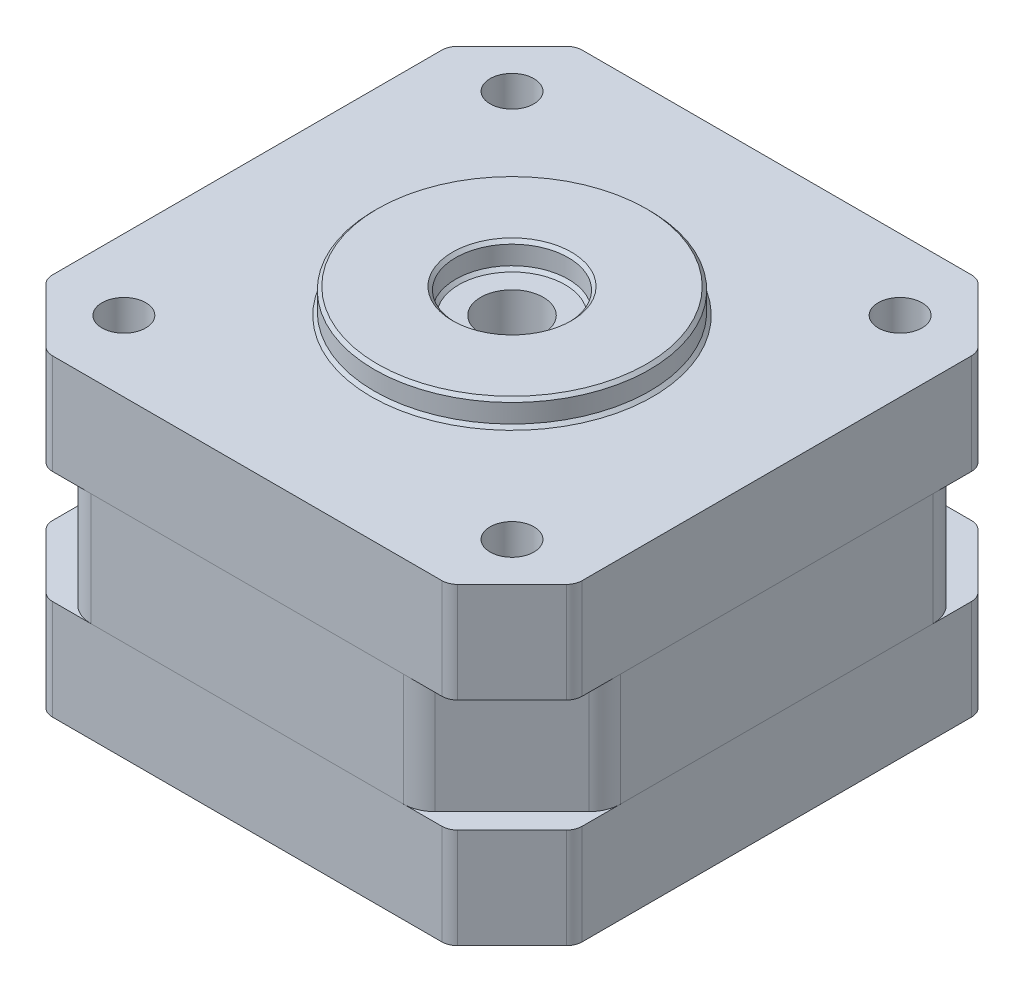
from build123d import *

# Parameters (mm, degrees)
SKETCH1_W           = 42.3
SKETCH1_H           = 42.3
BOSS_EXTRUDE1_DEPTH = 8.001
CHAMFER1_SIZE       = 5.08
SKETCH2_W           = 42.3
SKETCH2_H           = 42.3
BOSS_EXTRUDE2_DEPTH = 8.9916
CHAMFER3_SIZE       = 7.62
FILLET1_R           = 2.54
FILLET2_R           = 1.27
SKETCH3_W           = 42.3
SKETCH3_H           = 42.3
BOSS_EXTRUDE3_DEPTH = 8.001
CHAMFER4_SIZE       = 5.08
FILLET3_R           = 1.27
SKETCH4_R           = 10.9982
SKETCH4_R_2         = 4.4958
BOSS_EXTRUDE4_DEPTH = 2
CHAMFER5_SIZE       = 0.254
SKETCH5_R           = 2.5019
CUT_EXTRUDE1_DEPTH  = 12.7
SKETCH6_R           = 1.75
CUT_EXTRUDE2_DEPTH  = 39.978520251


with BuildPart() as part:
    # Sketch1 → Boss-Extrude1 (new body)
    with BuildSketch(Plane(origin=(0, 0, 0), x_dir=(1, 0, 0), z_dir=(0, 1, 0))):
        Rectangle(SKETCH1_W, SKETCH1_H)
    extrude(amount=BOSS_EXTRUDE1_DEPTH)

    # Chamfer1
    chamfer1_edges = [part.edges().sort_by_distance(p)[0] for p in [
        (21.15, 4.0005, 21.15),
        (-21.15, 4.0005, 21.15),
        (-21.15, 4.0005, -21.15),
        (21.15, 4.0005, -21.15),
    ]]
    chamfer(chamfer1_edges, length=CHAMFER1_SIZE)

    # Fillet2
    fillet2_edges = [part.edges().sort_by_distance(p)[0] for p in [
        (16.07, 4.0005, 21.15),
        (-16.07, 4.0005, 21.15),
        (-21.15, 4.0005, -16.07),
        (-21.15, 4.0005, 16.07),
        (16.07, 4.0005, -21.15),
        (-16.07, 4.0005, -21.15),
        (21.15, 4.0005, 16.07),
        (21.15, 4.0005, -16.07),
    ]]
    fillet(fillet2_edges, radius=FILLET2_R)


with BuildPart() as body_2:
    # Sketch2 → Boss-Extrude2 (new body)
    with BuildSketch(Plane(origin=(0, 8.001, 0), x_dir=(1, 0, 0), z_dir=(0, 1, 0))):
        Rectangle(SKETCH2_W, SKETCH2_H)
    extrude(amount=BOSS_EXTRUDE2_DEPTH)

    # Chamfer3
    chamfer3_edges = [body_2.edges().sort_by_distance(p)[0] for p in [
        (21.15, 12.4968, 21.15),
        (-21.15, 12.4968, 21.15),
        (-21.15, 12.4968, -21.15),
        (21.15, 12.4968, -21.15),
    ]]
    chamfer(chamfer3_edges, length=CHAMFER3_SIZE)

    # Fillet1
    fillet1_edges = [body_2.edges().sort_by_distance(p)[0] for p in [
        (-21.15, 12.4968, 13.53),
        (-21.15, 12.4968, -13.53),
        (13.53, 12.4968, -21.15),
        (-13.53, 12.4968, -21.15),
        (13.53, 12.4968, 21.15),
        (-13.53, 12.4968, 21.15),
        (21.15, 12.4968, -13.53),
        (21.15, 12.4968, 13.53),
    ]]
    fillet(fillet1_edges, radius=FILLET1_R)


with BuildPart() as body_3:
    # Sketch3 → Boss-Extrude3 (new body)
    with BuildSketch(Plane(origin=(0, 16.9926, 0), x_dir=(1, 0, 0), z_dir=(0, 1, 0))):
        Rectangle(SKETCH3_W, SKETCH3_H)
    extrude(amount=BOSS_EXTRUDE3_DEPTH)

    # Chamfer4
    chamfer4_edges = [body_3.edges().sort_by_distance(p)[0] for p in [
        (21.15, 20.9931, 21.15),
        (-21.15, 20.9931, 21.15),
        (-21.15, 20.9931, -21.15),
        (21.15, 20.9931, -21.15),
    ]]
    chamfer(chamfer4_edges, length=CHAMFER4_SIZE)

    # Fillet3
    fillet3_edges = [body_3.edges().sort_by_distance(p)[0] for p in [
        (16.07, 20.9931, 21.15),
        (-16.07, 20.9931, 21.15),
        (-21.15, 20.9931, -16.07),
        (-21.15, 20.9931, 16.07),
        (16.07, 20.9931, -21.15),
        (-16.07, 20.9931, -21.15),
        (21.15, 20.9931, 16.07),
        (21.15, 20.9931, -16.07),
    ]]
    fillet(fillet3_edges, radius=FILLET3_R)

    # Sketch4 → Boss-Extrude4 (add)
    with BuildSketch(Plane(origin=(0, 24.9936, 0), x_dir=(1, 0, 0), z_dir=(0, 1, 0))):
        with Locations(Location((0, 0, 0), (0, 0, 270))):
            Circle(SKETCH4_R)
        with Locations(Location((0, 0, 0), (0, 0, 270))):
            Circle(SKETCH4_R_2, mode=Mode.SUBTRACT)
    extrude(amount=BOSS_EXTRUDE4_DEPTH)

    # Chamfer5
    chamfer5_edges = [body_3.edges().sort_by_distance(p)[0] for p in [
        (0, 26.9936, -10.9982),
        (0, 24.9936, -10.9982),
        (0, 26.9936, -4.4958),
        (0, 24.9936, -4.4958),
    ]]
    chamfer(chamfer5_edges, length=CHAMFER5_SIZE)


with BuildPart() as cut_extrude1_tool:
    # Sketch5 → Cut-Extrude1 (new body)
    with BuildSketch(Plane(origin=(0, 24.9936, 0), x_dir=(1, 0, 0), z_dir=(0, 1, 0))):
        with Locations(Location((0, 0, 0), (0, 0, 270))):
            Circle(SKETCH5_R)
    extrude(amount=-CUT_EXTRUDE1_DEPTH)


with BuildPart() as body_2_1:
    add(body_2.part)

    # Cut-Extrude1: cut by cut_extrude1_tool
    add(cut_extrude1_tool.part, mode=Mode.SUBTRACT)


with BuildPart() as body_3_1:
    add(body_3.part)

    # Cut-Extrude1: cut by cut_extrude1_tool
    add(cut_extrude1_tool.part, mode=Mode.SUBTRACT)


with BuildPart() as cut_extrude2_tool:
    # Sketch6 → Cut-Extrude2 (new, through all)
    with BuildSketch(Plane(origin=(0, 24.9936, 0), x_dir=(1, 0, 0), z_dir=(0, 1, 0))):
        with Locations(Location((15.5, -15.5, 0), (0, 0, 270))):
            Circle(SKETCH6_R)
        with Locations(Location((-15.499999976, -15.5, 0), (0, 0, 270))):
            Circle(SKETCH6_R)
        with Locations(Location((-15.499999976, 15.499999976, 0), (0, 0, 270))):
            Circle(SKETCH6_R)
        with Locations(Location((15.5, 15.499999976, 0), (0, 0, 270))):
            Circle(SKETCH6_R)
    extrude(amount=-CUT_EXTRUDE2_DEPTH)


with BuildPart() as part_1:
    add(part.part)

    # Cut-Extrude2: cut by cut_extrude2_tool
    add(cut_extrude2_tool.part, mode=Mode.SUBTRACT)


with BuildPart() as body_2_2:
    add(body_2_1.part)

    # Cut-Extrude2: cut by cut_extrude2_tool
    add(cut_extrude2_tool.part, mode=Mode.SUBTRACT)


with BuildPart() as body_3_2:
    add(body_3_1.part)

    # Cut-Extrude2: cut by cut_extrude2_tool
    add(cut_extrude2_tool.part, mode=Mode.SUBTRACT)


solid = Compound([part_1.part, body_2_2.part, body_3_2.part])
